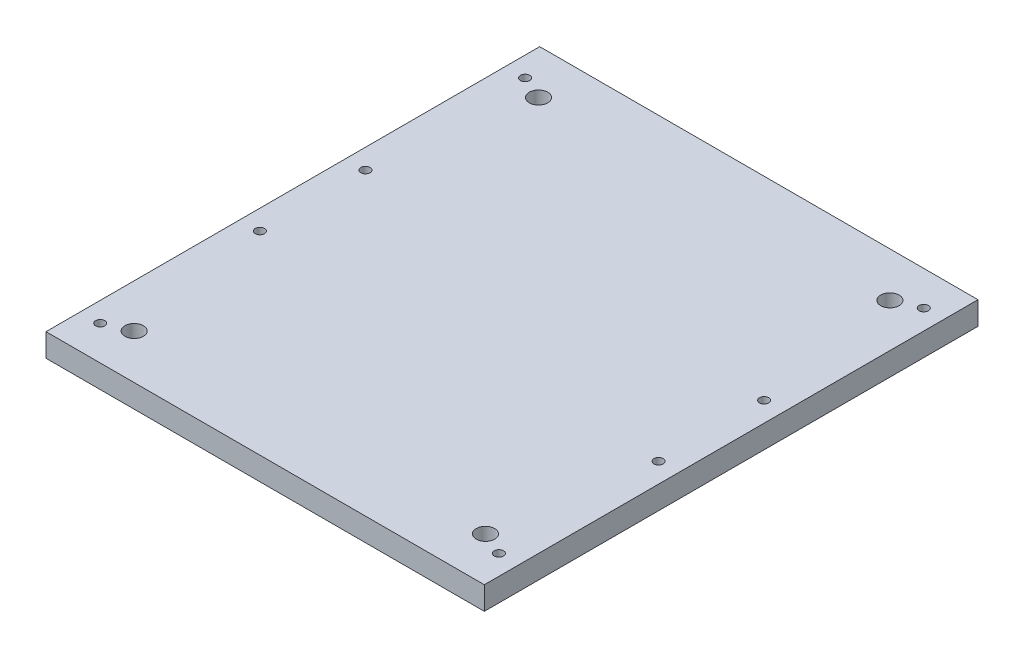
from build123d import *

# Parameters (mm, degrees)
SKETCH2_R                                  = 2
BOSS_EXTRUDE1_DEPTH                        = 5
CUT_EXTRUDE1_REACH                         = 73.718
SKETCH4_R                                  = 1
MIRROR2_COPY_1_REACH                       = 73.718
MIRROR2_COPY_1_SKETCH_R                    = 1
MIRROR2_AT_THE_SECOND_PLANE_COPY_1_REACH   = 73.718
MIRROR2_AT_THE_SECOND_PLANE_COPY_1_SKETC_R = 1
MIRROR2_AT_THE_SECOND_PLANE_COPY_2_REACH   = 73.718
MIRROR2_AT_THE_SECOND_PLANE_COPY_2_SKETC_R = 1
MIRROR2_AT_THE_SECOND_PLANE_COPY_3_REACH   = 73.718
MIRROR2_AT_THE_SECOND_PLANE_COPY_3_SKETC_R = 1


with BuildPart() as part:
    # Sketch2 → Boss-Extrude1 (new body)
    # profile 1 of 2: a face of its own
    with BuildSketch(Plane(origin=(0, 0, 0), x_dir=(1, 0, 0), z_dir=(0, 1, 0))):
        with BuildLine():
            ThreePointArc((38.075, -45.825), (36.660786438, -42.410786438), (40.075, -43.825))
            Line((40.075, -43.825), (47.5, -43.825))
            Line((47.5, -43.825), (47.5, 53.5))
            Line((47.5, 53.5), (-47.5, 53.5))
            Line((-47.5, 53.5), (-47.5, -53.5))
            Line((-47.5, -53.5), (38.075, -53.5))
            Line((38.075, -53.5), (38.075, -45.825))
        make_face()
        with Locations(Location((-38.075, -43.825, 0), (0, 0, 270))):
            Circle(SKETCH2_R, mode=Mode.SUBTRACT)
        with Locations(Location((-38.075, 43.825, 0), (0, 0, 270))):
            Circle(SKETCH2_R, mode=Mode.SUBTRACT)
        with Locations(Location((38.075, 43.825, 0), (0, 0, 270))):
            Circle(SKETCH2_R, mode=Mode.SUBTRACT)
    # profile 2 of 2: a face of its own
    with BuildSketch(Plane(origin=(0, 0, 0), x_dir=(1, 0, 0), z_dir=(0, 1, 0))):
        with BuildLine():
            Line((47.5, -43.825), (40.075, -43.825))
            ThreePointArc((40.075, -43.825), (39.489213562, -45.239213562), (38.075, -45.825))
            Line((38.075, -45.825), (38.075, -53.5))
            Line((38.075, -53.5), (47.5, -53.5))
            Line((47.5, -53.5), (47.5, -43.825))
        make_face()
    extrude(amount=BOSS_EXTRUDE1_DEPTH)

    # Sketch4 → Cut-Extrude1 (cut, up to next)
    with BuildSketch(Plane(origin=(0, 5, 0), x_dir=(1, 0, 0), z_dir=(0, 1, 0)), mode=Mode.PRIVATE) as cut_extrude1_sk1:
        with Locations(Location((43.205, 46.04, 0), (0, 0, 270))):
            Circle(SKETCH4_R)
    cut_extrude1_tool1 = extrude(cut_extrude1_sk1.sketch, amount=-CUT_EXTRUDE1_REACH, mode=Mode.PRIVATE) & part.part
    cut_extrude1 = cut_extrude1_tool1.solids().sort_by_distance((43.205, 5, -46.04))[0]
    add(cut_extrude1, mode=Mode.SUBTRACT)

    # Mirror1: Cut-Extrude1 across plane
    add(cut_extrude1.mirror(Plane(origin=(0, 0, -28.738611276), x_dir=(1, 0, 0), z_dir=(0, 0, -1))), mode=Mode.SUBTRACT)

    # Mirror2: Cut-Extrude1 across plane
    add(cut_extrude1.mirror(Plane(origin=(0, 0, 0), x_dir=(0, 0, 1), z_dir=(1, 0, 0))), mode=Mode.SUBTRACT)

    # Mirror2 copy 1 sketch → Mirror2 copy 1 (cut, up to next)
    with BuildSketch(Plane(origin=(0, 5, -57.477222552), x_dir=(-1, 0, 0), z_dir=(0, 1, 0)), mode=Mode.PRIVATE) as mirror2_copy_1_sk1:
        with Locations(Location((43.205, 46.04, 0), (0, 0, 270))):
            Circle(MIRROR2_COPY_1_SKETCH_R)
    mirror2_copy_1_tool1 = extrude(mirror2_copy_1_sk1.sketch, amount=-MIRROR2_COPY_1_REACH, mode=Mode.PRIVATE) & part.part
    add(mirror2_copy_1_tool1.solids().sort_by_distance((-43.205, 5, -11.437222552))[0], mode=Mode.SUBTRACT)

    # Mirror2 at the second plane: Cut-Extrude1 across plane
    add(cut_extrude1.mirror(Plane.XY), mode=Mode.SUBTRACT)

    # Mirror2 at the second plane copy 1 sketc → Mirror2 at the second plane copy 1 (cut, up to next)
    with BuildSketch(Plane(origin=(0, 5, 57.477222552), x_dir=(1, 0, 0), z_dir=(0, 1, 0)), mode=Mode.PRIVATE) as mirror2_at_the_second_plane_copy_1_sk1:
        with Locations(Location((43.205, 46.04, 0), (0, 0, 270))):
            Circle(MIRROR2_AT_THE_SECOND_PLANE_COPY_1_SKETC_R)
    mirror2_at_the_second_plane_copy_1_tool1 = extrude(mirror2_at_the_second_plane_copy_1_sk1.sketch, amount=-MIRROR2_AT_THE_SECOND_PLANE_COPY_1_REACH, mode=Mode.PRIVATE) & part.part
    add(mirror2_at_the_second_plane_copy_1_tool1.solids().sort_by_distance((43.205, 5, 11.437222552))[0], mode=Mode.SUBTRACT)

    # Mirror2 at the second plane copy 2 sketc → Mirror2 at the second plane copy 2 (cut, up to next)
    with BuildSketch(Plane(origin=(0, 5, 0), x_dir=(-1, 0, 0), z_dir=(0, 1, 0)), mode=Mode.PRIVATE) as mirror2_at_the_second_plane_copy_2_sk1:
        with Locations(Location((43.205, 46.04, 0), (0, 0, 270))):
            Circle(MIRROR2_AT_THE_SECOND_PLANE_COPY_2_SKETC_R)
    mirror2_at_the_second_plane_copy_2_tool1 = extrude(mirror2_at_the_second_plane_copy_2_sk1.sketch, amount=-MIRROR2_AT_THE_SECOND_PLANE_COPY_2_REACH, mode=Mode.PRIVATE) & part.part
    add(mirror2_at_the_second_plane_copy_2_tool1.solids().sort_by_distance((-43.205, 5, 46.04))[0], mode=Mode.SUBTRACT)

    # Mirror2 at the second plane copy 3 sketc → Mirror2 at the second plane copy 3 (cut, up to next)
    with BuildSketch(Plane(origin=(0, 5, 57.477222552), x_dir=(-1, 0, 0), z_dir=(0, 1, 0)), mode=Mode.PRIVATE) as mirror2_at_the_second_plane_copy_3_sk1:
        with Locations((43.205, -46.04)):
            Circle(MIRROR2_AT_THE_SECOND_PLANE_COPY_3_SKETC_R)
    mirror2_at_the_second_plane_copy_3_tool1 = extrude(mirror2_at_the_second_plane_copy_3_sk1.sketch, amount=-MIRROR2_AT_THE_SECOND_PLANE_COPY_3_REACH, mode=Mode.PRIVATE) & part.part
    add(mirror2_at_the_second_plane_copy_3_tool1.solids().sort_by_distance((-43.205, 5, 11.437222552))[0], mode=Mode.SUBTRACT)


solid = part.part
